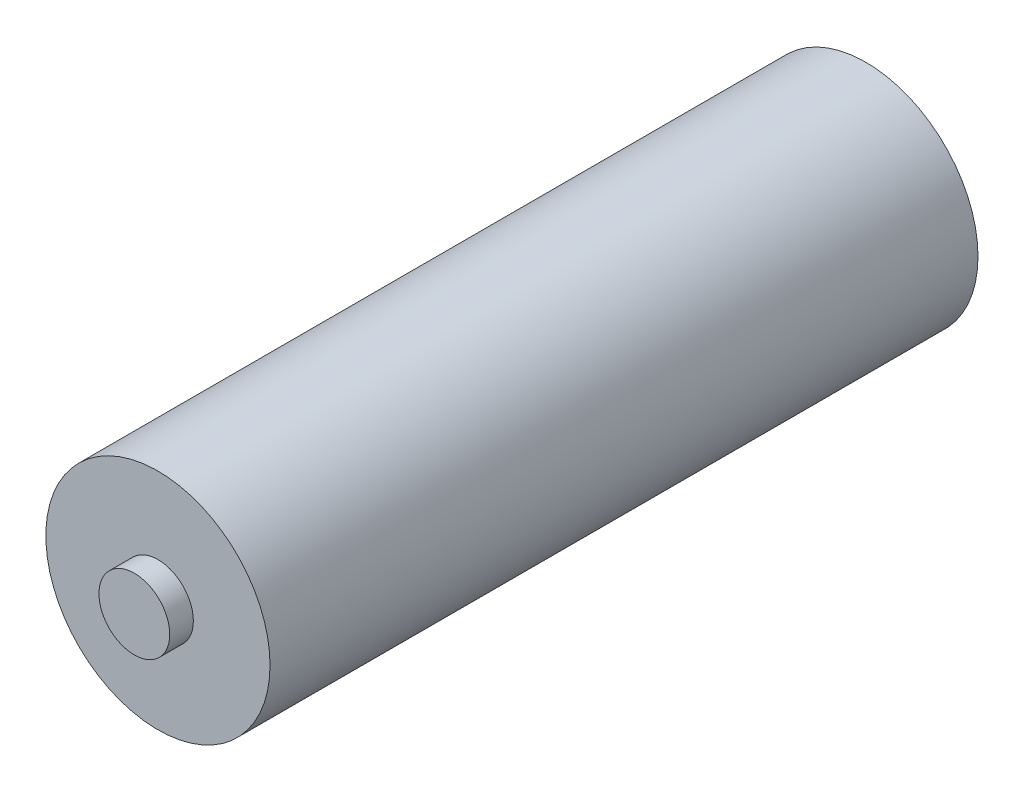
from build123d import *

# Parameters (mm, degrees)
SKETCH1_R                = 47.5
BOSS_EXTRUDE1_DEPTH      = 150
BOSS_EXTRUDE2_DEPTH      = 10
BOSS_EXTRUDE2_DEPTH_BACK = 310
SKETCH2_R                = 15


with BuildPart() as part:
    # Sketch1 → Boss-Extrude1 (new, symmetric)
    with BuildSketch(Plane.XY):
        Circle(SKETCH1_R)
    extrude(amount=BOSS_EXTRUDE1_DEPTH, both=True)

    # Sketch2 → Boss-Extrude2 (add, two sides: drawn at the far end of the back side and taken through both)
    with BuildSketch(Plane.XY.offset(150).offset(-BOSS_EXTRUDE2_DEPTH_BACK)):
        Circle(SKETCH2_R)
    extrude(amount=BOSS_EXTRUDE2_DEPTH + BOSS_EXTRUDE2_DEPTH_BACK)


solid = part.part
